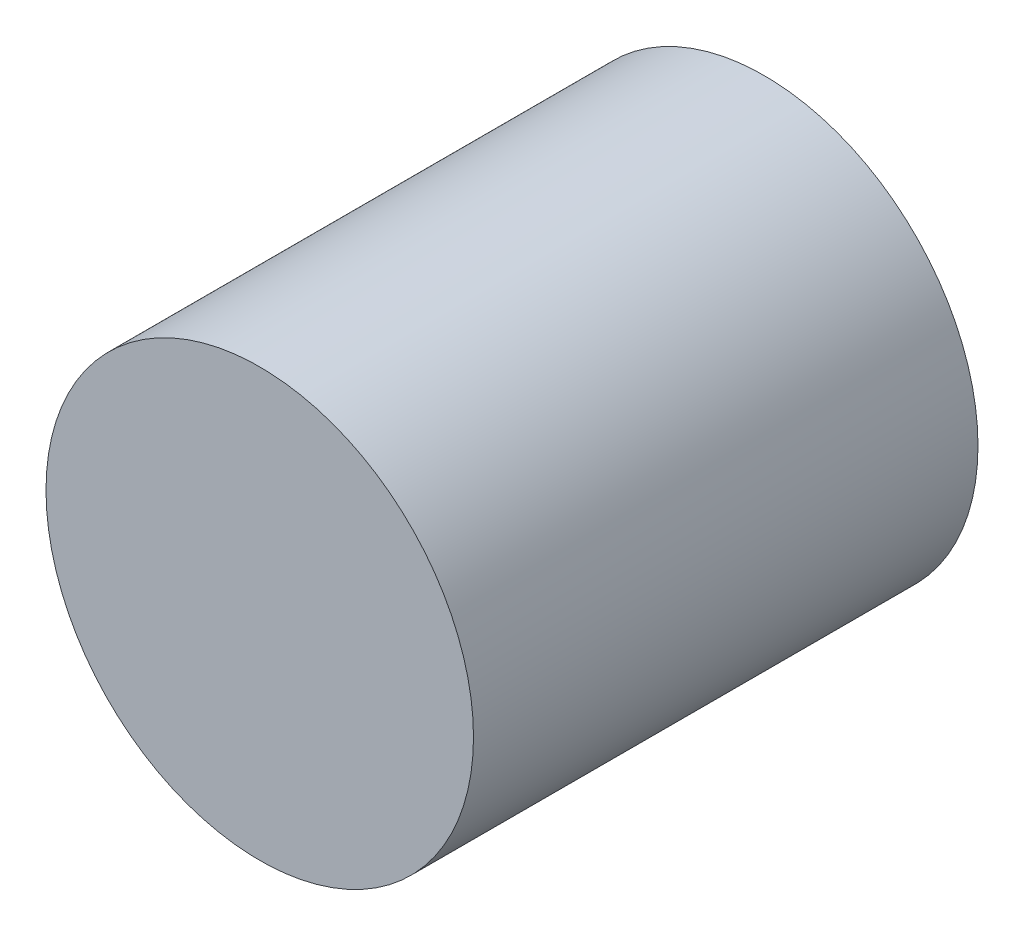
from build123d import *

# Parameters (mm, degrees)
ESQUISSE1_R        = 16.1
BOSS_EXTRU_1_DEPTH = 38


with BuildPart() as part:
    # Esquisse1 → Boss.-Extru.1 (new body)
    with BuildSketch(Plane.XY):
        Circle(ESQUISSE1_R)
    extrude(amount=BOSS_EXTRU_1_DEPTH)


solid = part.part
